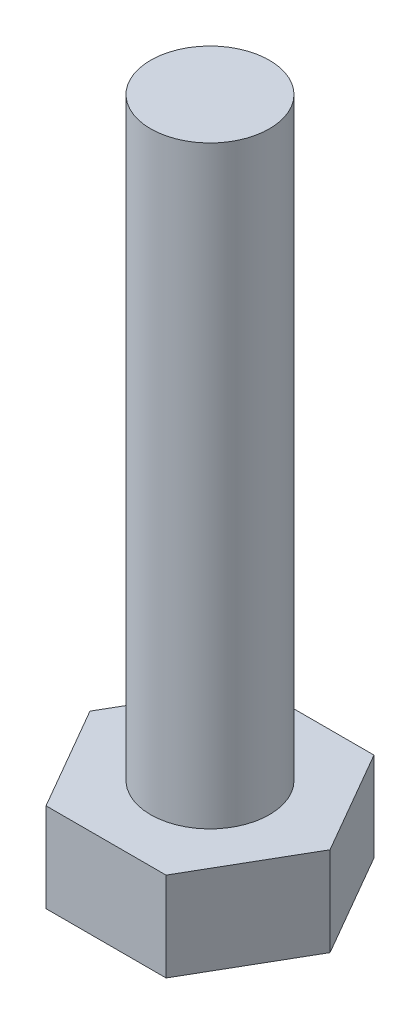
from build123d import *

# Parameters (mm, degrees)
BOSS_EXTRUDE1_DEPTH = 3
SKETCH2_R           = 2
BOSS_EXTRUDE2_DEPTH = 20


with BuildPart() as part:
    # Sketch1 → Boss-Extrude1 (new body)
    with BuildSketch(Plane(origin=(0, 0, 0), x_dir=(1, 0, 0), z_dir=(0, 1, 0))):
        Polygon((-4.041451884, 0), (-2.020725942, -3.5), (2.020725942, -3.5), (4.041451884, 0), (2.020725942, 3.5), (-2.020725942, 3.5), align=None)
    extrude(amount=BOSS_EXTRUDE1_DEPTH)

    # Sketch2 → Boss-Extrude2 (add)
    with BuildSketch(Plane(origin=(0, 3, 0), x_dir=(1, 0, 0), z_dir=(0, 1, 0))):
        with Locations(Location((0, 0, 0), (0, 0, 270))):
            Circle(SKETCH2_R)
    extrude(amount=BOSS_EXTRUDE2_DEPTH)


solid = part.part
